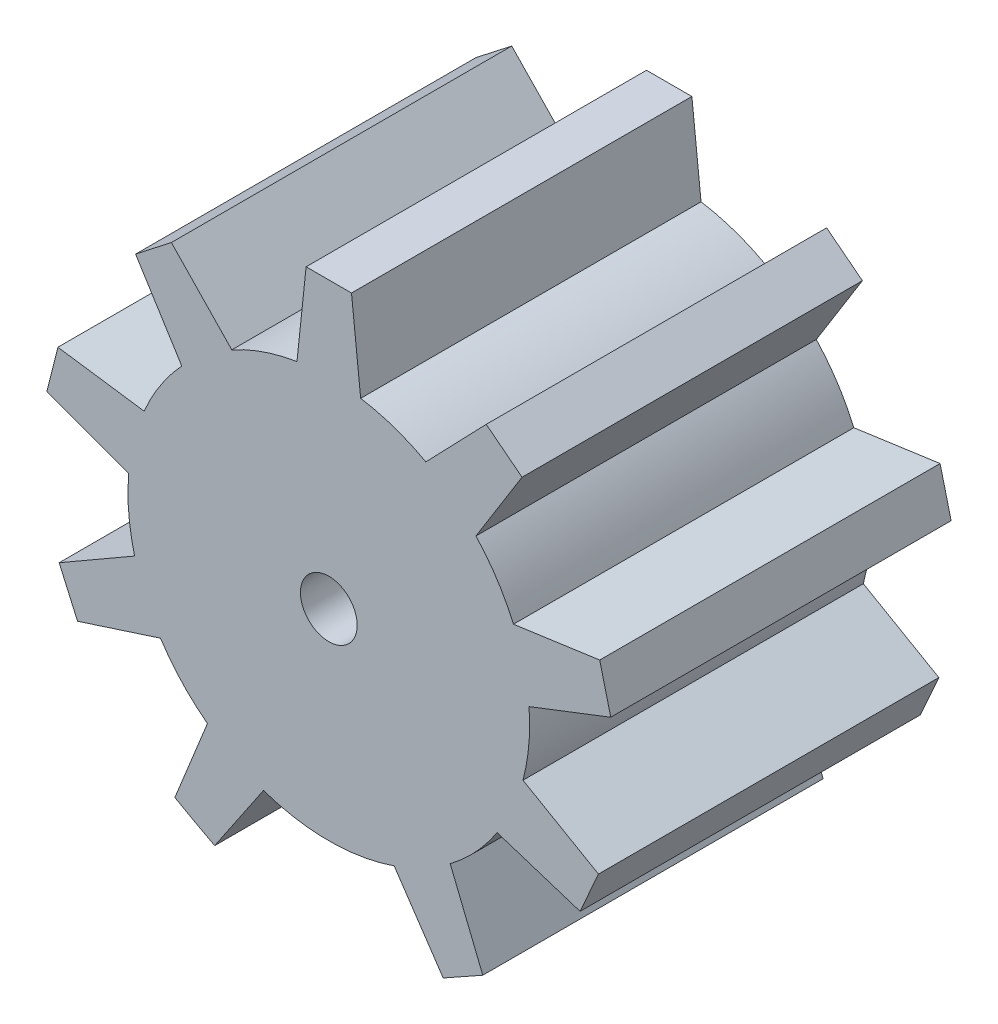
from build123d import *

# Parameters (mm, degrees)
EXTRUDE_2_DEPTH     = 15
SKETCH_5_R          = 1.25
CUT_EXTRUDE_1_DEPTH = 15


with BuildPart() as part:
    # Эскиз3 → Бобышка-Вытянуть2 (new body)
    with BuildSketch(Plane.XY):
        with BuildLine():
            Line((-1, 12.556672608), (0, 12.556672608))
            Line((0, 12.556672608), (1, 12.556672608))
            Line((1, 12.556672608), (1.403768611, 8.737959355))
            ThreePointArc((1.403768611, 8.737959355), (2.882480289, 8.367425374), (4.275666751, 7.748623996))
            Line((4.275666751, 7.748623996), (6.938281237, 10.513338217))
            Line((6.938281237, 10.513338217), (8.514814211, 9.282670194))
            Line((8.514814211, 9.282670194), (6.483307331, 6.024053955))
            ThreePointArc((6.483307331, 6.024053955), (7.419229042, 4.824680344), (8.135910959, 3.482736406))
            Line((8.135910959, 3.482736406), (11.938429132, 4.017951822))
            Line((11.938429132, 4.017951822), (12.423885361, 2.077763107))
            Line((12.423885361, 2.077763107), (8.823580607, 0.683319303))
            ThreePointArc((8.823580607, 0.683319303), (8.813761391, -0.800068834), (8.556312106, -2.260978362))
            Line((8.556312106, -2.260978362), (11.88304599, -4.178904758))
            Line((11.88304599, -4.178904758), (11.071850771, -6.007008197))
            Line((11.071850771, -6.007008197), (7.417581711, -4.827212608))
            ThreePointArc((7.417581711, -4.827212608), (6.479864305, -6.027757343), (5.350154649, -7.049705329))
            Line((5.350154649, -7.049705329), (6.785807353, -10.588258594))
            Line((6.785807353, -10.588258594), (5.913418577, -11.077071262))
            Line((5.913418577, -11.077071262), (5.041029802, -11.565883931))
            Line((5.041029802, -11.565883931), (2.88053291, -8.36809597))
            ThreePointArc((2.88053291, -8.36809597), (0.000835422, -8.849999961), (-2.878952996, -8.368639653))
            Line((-2.878952996, -8.368639653), (-5.029072142, -11.548959277))
            Line((-5.029072142, -11.548959277), (-5.911327166, -11.078187493))
            Line((-5.911327166, -11.078187493), (-6.783800352, -10.589525504))
            Line((-6.783800352, -10.589525504), (-5.348823599, -7.050715291))
            ThreePointArc((-5.348823599, -7.050715291), (-6.479295244, -6.028369028), (-7.417581672, -4.827212668))
            Line((-7.417581672, -4.827212668), (-11.071850724, -6.007008285))
            Line((-11.071850724, -6.007008285), (-11.883045968, -4.178904821))
            Line((-11.883045968, -4.178904821), (-8.556312093, -2.260978407))
            ThreePointArc((-8.556312093, -2.260978407), (-8.817386806, -0.759071749), (-8.816843455, 0.765357101))
            Line((-8.816843455, 0.765357101), (-12.423885379, 2.077762999))
            Line((-12.423885379, 2.077762999), (-11.938429167, 4.017951718))
            Line((-11.938429167, 4.017951718), (-8.138356697, 3.477017439))
            ThreePointArc((-8.138356697, 3.477017439), (-7.419229073, 4.824680297), (-6.479071962, 6.028609003))
            Line((-6.479071962, 6.028609003), (-8.514814242, 9.282670165))
            Line((-8.514814242, 9.282670165), (-6.938281272, 10.513338193))
            Line((-6.938281272, 10.513338193), (-4.275666751, 7.748623996))
            ThreePointArc((-4.275666751, 7.748623996), (-2.882480289, 8.367425373), (-1.403768611, 8.737959355))
            Line((-1.403768611, 8.737959355), (-1, 12.556672608))
        make_face()
    extrude(amount=EXTRUDE_2_DEPTH)

    # Эскиз5 → Вырез-Вытянуть1 (cut)
    with BuildSketch(Plane(origin=(0, 0, 0), x_dir=(-1, 0, 0), z_dir=(0, 0, -1))):
        Circle(SKETCH_5_R)
    extrude(amount=-CUT_EXTRUDE_1_DEPTH, mode=Mode.SUBTRACT)


solid = part.part
